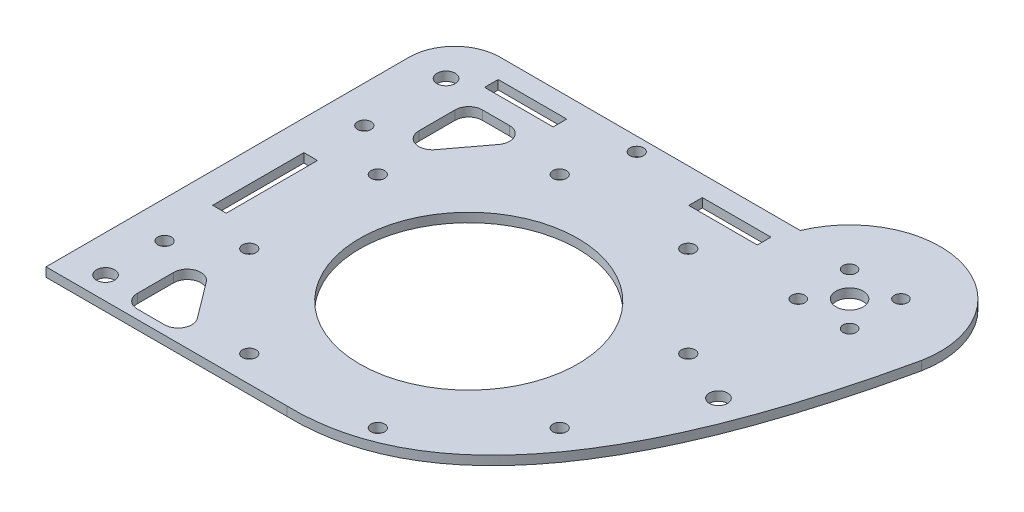
from build123d import *

# Parameters (mm, degrees)
SKETCH_1_R      = 24
SKETCH_1_R_2    = 3
SKETCH_1_R_3    = 2
SKETCH_1_R_4    = 1.45
SKETCH_1_R_5    = 1.5
SKETCH_1_W      = 15.1
SKETCH_1_H      = 3
SKETCH_1_W_2    = 3
SKETCH_1_H_2    = 20.1
EXTRUDE_1_DEPTH = 2
FILLET_1_R      = 10
FILLET_2_R      = 3


with BuildPart() as part:
    # 草图1 → 凸台-拉伸1 (new body)
    with BuildSketch(Plane(origin=(0, 0, 0), x_dir=(1, 0, 0), z_dir=(0, 1, 0))):
        with BuildLine():
            Line((0, -40), (-53.115531196, -40))
            Line((-53.115531196, -40), (-53.115531196, 50))
            Line((-53.115531196, 50), (23.035101229, 50))
            ThreePointArc((23.035101229, 50), (47.273662895, 61.517967257), (61.152805225, 38.549709823))
            add(Edge.make_bspline(
                [(61.152805225, 38.549709823), (43.767754296, -41.044262003), (0, -40)],
                knots=[0, 0, 0, 0.762442078, 0.762442078, 0.762442078], degree=2))
        make_face()
        with Locations(Location((0, 0, 0), (0, 0, 270))):
            Circle(SKETCH_1_R, mode=Mode.SUBTRACT)
        with Locations(Location((41.5198, 42.363514464, 0), (0, 0, 270))):
            Circle(SKETCH_1_R_2, mode=Mode.SUBTRACT)
        with Locations(Location((46, 9, 0), (0, 0, 270))):
            Circle(SKETCH_1_R_3, mode=Mode.SUBTRACT)
        with Locations(Location((-45, 40, 0), (0, 0, 270))):
            Circle(SKETCH_1_R_3, mode=Mode.SUBTRACT)
        with Locations(Location((-45, -35, 0), (0, 0, 270))):
            Circle(SKETCH_1_R_3, mode=Mode.SUBTRACT)
        with Locations(Location((35.862945751, 48.020368713, 0), (0, 0, 270))):
            Circle(SKETCH_1_R_4, mode=Mode.SUBTRACT)
        with Locations(Location((47.176654249, 48.020368713, 0), (0, 0, 270))):
            Circle(SKETCH_1_R_4, mode=Mode.SUBTRACT)
        with Locations(Location((47.176654249, 36.706660215, 0), (0, 0, 270))):
            Circle(SKETCH_1_R_4, mode=Mode.SUBTRACT)
        with Locations(Location((35.862945751, 36.706660215, 0), (0, 0, 270))):
            Circle(SKETCH_1_R_4, mode=Mode.SUBTRACT)
        with Locations(Location((-45, 22, 0), (0, 0, 270))):
            Circle(SKETCH_1_R_5, mode=Mode.SUBTRACT)
        with Locations(Location((-45, -22, 0), (0, 0, 270))):
            Circle(SKETCH_1_R_5, mode=Mode.SUBTRACT)
        with Locations(Location((34.183542703, 14.159286998, 0), (0, 0, 270))):
            Circle(SKETCH_1_R_5, mode=Mode.SUBTRACT)
        with Locations(Location((34.183542703, -14.159286998, 0), (0, 0, 270))):
            Circle(SKETCH_1_R_5, mode=Mode.SUBTRACT)
        with Locations(Location((14.159286998, -34.183542703, 0), (0, 0, 270))):
            Circle(SKETCH_1_R_5, mode=Mode.SUBTRACT)
        with Locations(Location((-14.159286998, -34.183542703, 0), (0, 0, 270))):
            Circle(SKETCH_1_R_5, mode=Mode.SUBTRACT)
        with Locations(Location((-34.183542703, -14.159286998, 0), (0, 0, 270))):
            Circle(SKETCH_1_R_5, mode=Mode.SUBTRACT)
        with Locations(Location((-34.183542703, 14.159286998, 0), (0, 0, 270))):
            Circle(SKETCH_1_R_5, mode=Mode.SUBTRACT)
        with Locations(Location((-14.159286998, 34.183542703, 0), (0, 0, 270))):
            Circle(SKETCH_1_R_5, mode=Mode.SUBTRACT)
        with Locations(Location((14.159286998, 34.183542703, 0), (0, 0, 270))):
            Circle(SKETCH_1_R_5, mode=Mode.SUBTRACT)
        with Locations(Location((-10, 47, 0), (0, 0, 270))):
            Circle(SKETCH_1_R_5, mode=Mode.SUBTRACT)
        with Locations((-31.49510891, 44.033375725)):
            Rectangle(SKETCH_1_W, SKETCH_1_H, mode=Mode.SUBTRACT)
        with Locations((13.50489109, 44)):
            Rectangle(SKETCH_1_W, SKETCH_1_H, mode=Mode.SUBTRACT)
        with Locations((-45, 0.135026031)):
            Rectangle(SKETCH_1_W_2, SKETCH_1_H_2, mode=Mode.SUBTRACT)
        Polygon((-38, 38), (-38, 18), (-23, 38), align=None, mode=Mode.SUBTRACT)
        Polygon((-38, -38), (-38, -18), (-23, -38), align=None, mode=Mode.SUBTRACT)
    extrude(amount=EXTRUDE_1_DEPTH)

    # 圆角1
    fillet_1_edges = [part.edges().sort_by_distance(p)[0] for p in [
        (-53.115531196, 1, -50),
    ]]
    fillet(fillet_1_edges, radius=FILLET_1_R)

    # 圆角2
    fillet_2_edges = [part.edges().sort_by_distance(p)[0] for p in [
        (-23, 1, -38),
        (-38, 1, -38),
        (-38, 1, -18),
        (-38, 1, 38),
        (-23, 1, 38),
        (-38, 1, 18),
    ]]
    fillet(fillet_2_edges, radius=FILLET_2_R)


solid = part.part
